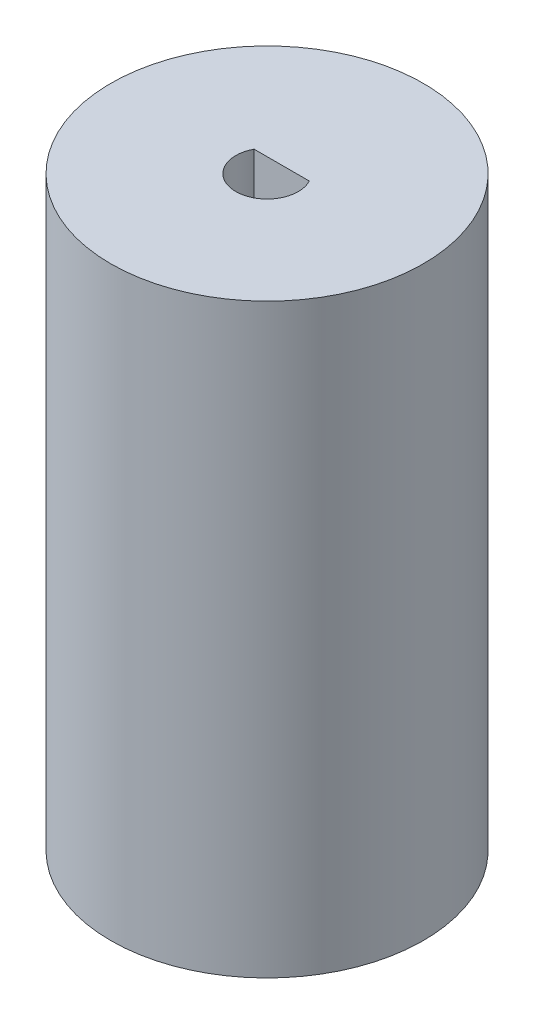
from build123d import *

# Parameters (mm, degrees)
SKETCH1_R           = 8
BOSS_EXTRUDE1_DEPTH = 30


with BuildPart() as part:
    # Sketch1 → Boss-Extrude1 (new body)
    with BuildSketch(Plane(origin=(0, 0, 0), x_dir=(1, 0, 0), z_dir=(0, 1, 0))):
        with Locations(Location((0, 0, 0), (0, 0, 270))):
            Circle(SKETCH1_R)
        with BuildLine():
            Line((-1.413329403, 0.75), (1.413329403, 0.75))
            ThreePointArc((1.413329403, 0.75), (0, -1.6), (-1.413329403, 0.75))
        make_face(mode=Mode.SUBTRACT)
    extrude(amount=BOSS_EXTRUDE1_DEPTH)


solid = part.part
